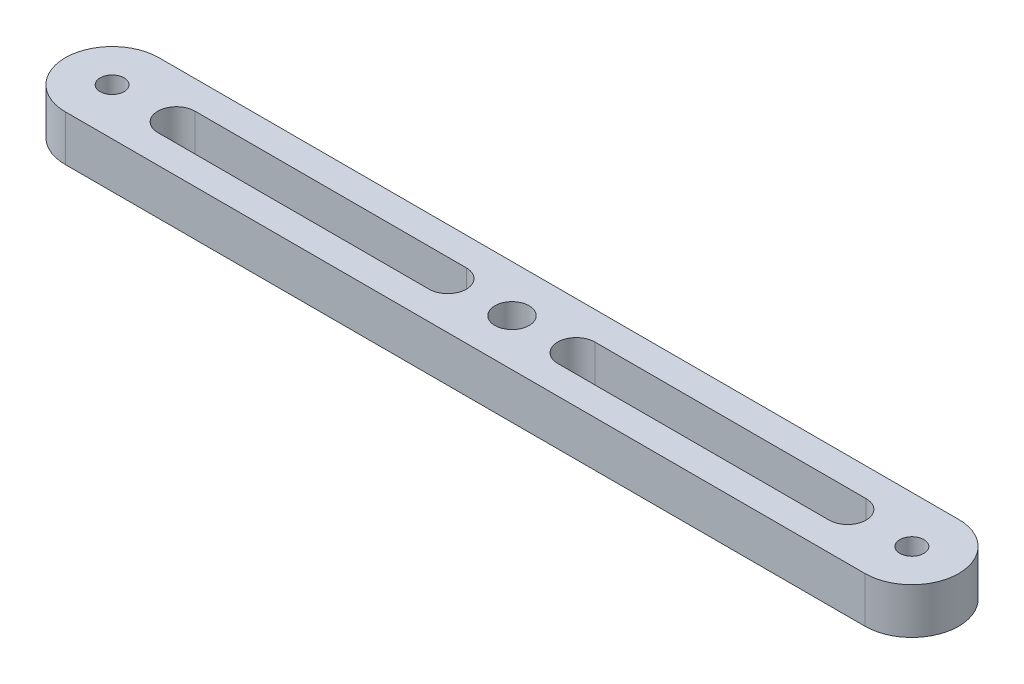
from build123d import *

# Parameters (mm, degrees)
BOSS_EXTRUDE1_DEPTH = 4
SKETCH2_R           = 1.5
CUT_EXTRUDE1_DEPTH  = 4
SKETCH6_R           = 1.05
CUT_EXTRUDE2_DEPTH  = 4
CUT_EXTRUDE3_DEPTH  = 40.517337967


with BuildPart() as part:
    # Sketch1 → Boss-Extrude1 (new body)
    with BuildSketch(Plane(origin=(0, 0, 0), x_dir=(1, 0, 0), z_dir=(0, 1, 0))):
        with BuildLine():
            Line((35, -4.1), (-35, -4.1))
            ThreePointArc((-35, -4.1), (-39.1, 0), (-35, 4.1))
            Line((-35, 4.1), (35, 4.1))
            ThreePointArc((35, 4.1), (39.1, 0), (35, -4.1))
        make_face()
    extrude(amount=-BOSS_EXTRUDE1_DEPTH)

    # Sketch2 → Cut-Extrude1 (cut)
    with BuildSketch(Plane(origin=(0, 0, 0), x_dir=(1, 0, 0), z_dir=(0, 1, 0))):
        with Locations(Location((0, 0, 0), (0, 0, 270))):
            Circle(SKETCH2_R)
    extrude(amount=-CUT_EXTRUDE1_DEPTH, mode=Mode.SUBTRACT)

    # Sketch6 → Cut-Extrude2 (cut)
    with BuildSketch(Plane(origin=(0, 0, 0), x_dir=(1, 0, 0), z_dir=(0, 1, 0))):
        with Locations(Location((-35, 0, 0), (0, 0, 270))):
            Circle(SKETCH6_R)
    cut_extrude2 = extrude(amount=-CUT_EXTRUDE2_DEPTH, mode=Mode.SUBTRACT)

    # Sketch7 → Cut-Extrude3 (cut, through all)
    with BuildSketch(Plane(origin=(0, 0, 0), x_dir=(1, 0, 0), z_dir=(0, 1, 0))):
        with BuildLine():
            Line((-29.375, 1.625), (-5.625, 1.625))
            ThreePointArc((-5.625, 1.625), (-4, 0), (-5.625, -1.625))
            Line((-5.625, -1.625), (-29.375, -1.625))
            ThreePointArc((-29.375, -1.625), (-31, 0), (-29.375, 1.625))
        make_face()
    cut_extrude3 = extrude(amount=-CUT_EXTRUDE3_DEPTH, mode=Mode.SUBTRACT)

    # Mirror1: Cut-Extrude2, Cut-Extrude3 across plane
    add(cut_extrude2.mirror(Plane(origin=(0, 0, 0), x_dir=(0, 0, 1), z_dir=(1, 0, 0))), mode=Mode.SUBTRACT)
    add(cut_extrude3.mirror(Plane(origin=(0, 0, 0), x_dir=(0, 0, 1), z_dir=(1, 0, 0))), mode=Mode.SUBTRACT)


solid = part.part
